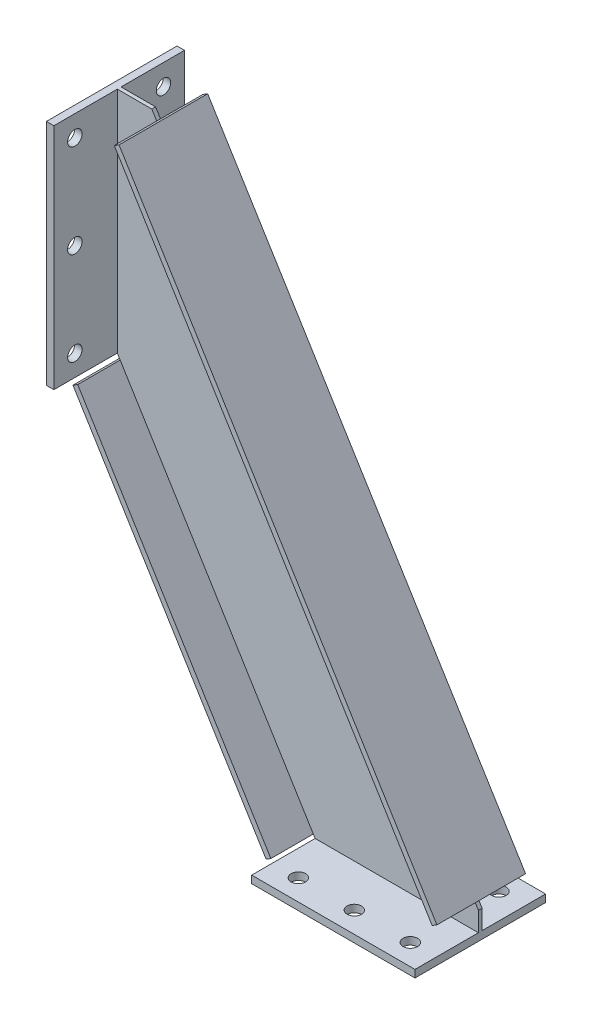
from build123d import *

# Parameters (mm, degrees)
SKETCH_1_W          = 774
SKETCH_1_H          = 1179
EXTRUDE_1_DEPTH     = 4
CUT_EXTRUDE_2_DEPTH = 8
SKETCH_3_W          = 280
SKETCH_3_H          = 490
EXTRUDE_3_DEPTH     = 16
SKETCH_4_R          = 15.5
CUT_EXTRUDE_4_DEPTH = 16
EXTRUDE_5_DEPTH     = 12
SKETCH_7_W          = 350
SKETCH_7_H          = 280
EXTRUDE_6_DEPTH     = 16
SKETCH_8_R          = 15.5
CUT_EXTRUDE_7_DEPTH = 16
SKETCH_9_W          = 190
SKETCH_9_H          = 1300
EXTRUDE_8_DEPTH     = 12


with BuildPart() as part:
    # 草图1 → 拉伸1 (new, symmetric)
    with BuildSketch(Plane.XY):
        with Locations((87, 89.5)):
            Rectangle(SKETCH_1_W, SKETCH_1_H)
    extrude(amount=EXTRUDE_1_DEPTH, both=True)

    # 草图2 → 拉伸2 (cut)
    with BuildSketch(Plane.XY.offset(4)):
        Polygon((-300, -500), (-300, 189), (124, -500), align=None)
        Polygon((-226, 679), (474, -458.5), (474, 679), align=None)
    extrude(amount=-CUT_EXTRUDE_2_DEPTH, mode=Mode.SUBTRACT)

    # 草图3 → 拉伸3 (add)
    with BuildSketch(Plane.ZY.offset(300)):
        with Locations((0, 434)):
            Rectangle(SKETCH_3_W, SKETCH_3_H)
    extrude(amount=EXTRUDE_3_DEPTH)

    # 草图4 → 拉伸4 (cut)
    with BuildSketch(Plane.ZY.offset(316)):
        with Locations((-95, 634)):
            Circle(SKETCH_4_R)
        with Locations((-95, 434)):
            Circle(SKETCH_4_R)
        with Locations((-95, 234)):
            Circle(SKETCH_4_R)
        with Locations(Location((95, 234, 0), (0, 0, 180))):
            Circle(SKETCH_4_R)
        with Locations(Location((95, 434, 0), (0, 0, 180))):
            Circle(SKETCH_4_R)
        with Locations(Location((95, 634, 0), (0, 0, 180))):
            Circle(SKETCH_4_R)
    extrude(amount=-CUT_EXTRUDE_4_DEPTH, mode=Mode.SUBTRACT)

    # 草图5 → 拉伸5 (add)
    with BuildSketch(Plane(origin=(-133.236051502, -81.991416309, 0), x_dir=(0, 0, 1), z_dir=(-0.8516583167045437, -0.5240974256643349, 0))):
        Polygon((0, 306.578208367), (95, 306.578208367), (95, -483.421791633), (-95, -483.421791633), (-95, 306.578208367), align=None)
    extrude(amount=EXTRUDE_5_DEPTH)

    # 草图7 → 拉伸6 (add)
    with BuildSketch(Plane.XZ.offset(500)):
        with Locations((299, 0)):
            Rectangle(SKETCH_7_W, SKETCH_7_H)
    extrude(amount=EXTRUDE_6_DEPTH)

    # 草图8 → 拉伸7 (cut)
    with BuildSketch(Plane.XZ.offset(516)):
        with Locations(Location((179, 95, 0), (0, 0, 270))):
            Circle(SKETCH_8_R)
        with Locations(Location((299, 95, 0), (0, 0, 270))):
            Circle(SKETCH_8_R)
        with Locations(Location((419, 95, 0), (0, 0, 270))):
            Circle(SKETCH_8_R)
        with Locations(Location((419, -95, 0), (0, 0, 90))):
            Circle(SKETCH_8_R)
        with Locations(Location((299, -95, 0), (0, 0, 90))):
            Circle(SKETCH_8_R)
        with Locations(Location((179, -95, 0), (0, 0, 90))):
            Circle(SKETCH_8_R)
    extrude(amount=-CUT_EXTRUDE_7_DEPTH, mode=Mode.SUBTRACT)

    # 草图9 → 拉伸8 (add)
    with BuildSketch(Plane(origin=(139.150214592, 85.630901288, 0), x_dir=(0, 0, -1), z_dir=(0.8516583167045437, 0.5240974256643349, 0))):
        with Locations((0, 26.722015243)):
            Rectangle(SKETCH_9_W, SKETCH_9_H)
    extrude(amount=EXTRUDE_8_DEPTH)


solid = part.part
